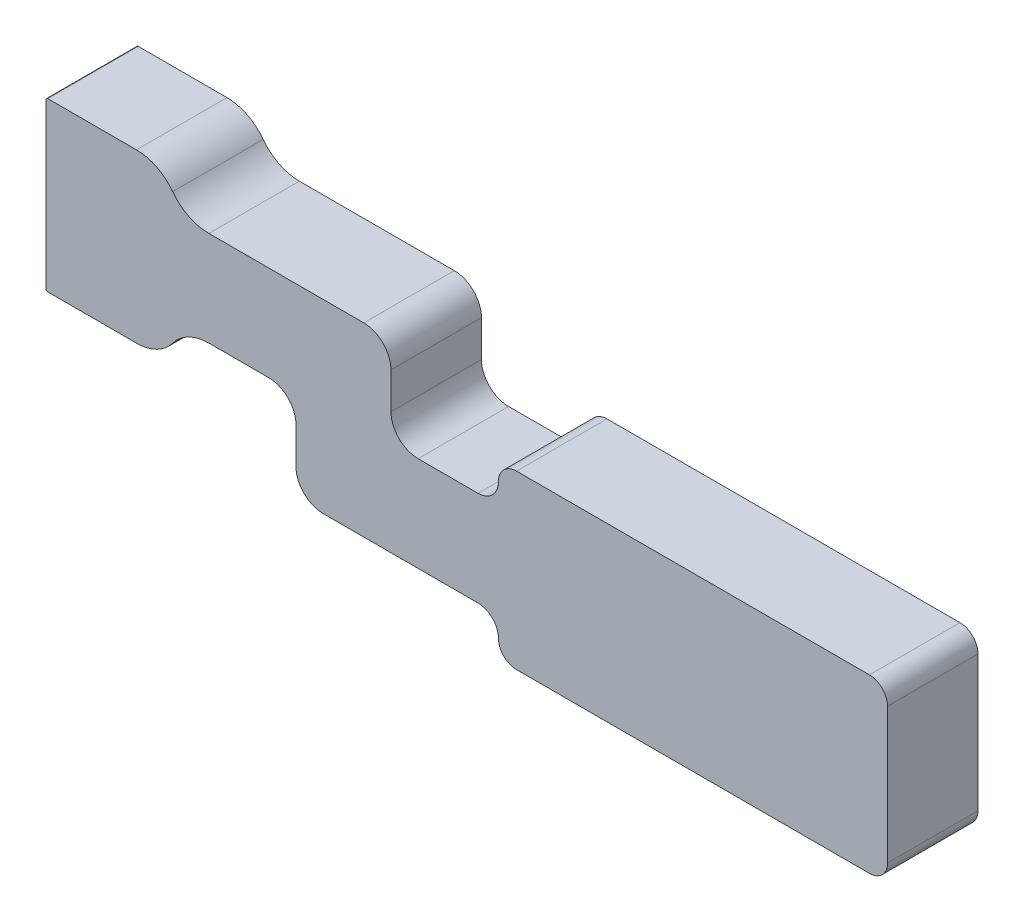
from build123d import *

# Parameters (mm, degrees)
BOSS_EXTRUDE2_DEPTH = 10


with BuildPart() as part:
    # Sketch1 → Boss-Extrude2 (new body)
    with BuildSketch(Plane(origin=(0, 0, 0), x_dir=(0, 1, 0), z_dir=(0, 0, 1))):
        with BuildLine():
            Line((19.25, 83), (19.25, 92.8))
            ThreePointArc((19.25, 92.8), (19.191421356, 92.941421356), (19.05, 93))
            Line((19.05, 93), (0.95, 93))
            ThreePointArc((0.95, 93), (0.808578644, 92.941421356), (0.75, 92.8))
            Line((0.75, 92.8), (0.75, 83))
            ThreePointArc((0.75, 83), (1.277864045, 80.763932023), (2.75, 79))
            ThreePointArc((2.75, 79), (4.222135955, 77.236067977), (4.75, 75))
            Line((4.75, 75), (4.75, 68.375))
            ThreePointArc((4.75, 68.375), (3.871320344, 66.253679656), (1.75, 65.375))
            Line((1.75, 65.375), (-2.25, 65.375))
            ThreePointArc((-2.25, 65.375), (-4.371320344, 64.496320344), (-5.25, 62.375))
            Line((-5.25, 62.375), (-5.25, 45.25))
            ThreePointArc((-5.25, 45.25), (-5.909009742, 43.659009742), (-7.5, 43))
            ThreePointArc((-7.5, 43), (-8.914213562, 42.414213562), (-9.5, 41))
            Line((-9.5, 41), (-9.5, 2))
            ThreePointArc((-9.5, 2), (-8.914213562, 0.585786438), (-7.5, 0))
            Line((-7.5, 0), (7.5, 0))
            ThreePointArc((7.5, 0), (8.914213562, 0.585786438), (9.5, 2))
            Line((9.5, 2), (9.5, 41))
            ThreePointArc((9.5, 41), (8.914213562, 42.414213562), (7.5, 43))
            ThreePointArc((7.5, 43), (5.909009742, 43.659009742), (5.25, 45.25))
            Line((5.25, 45.25), (5.25, 51.875))
            ThreePointArc((5.25, 51.875), (6.128679656, 53.996320344), (8.25, 54.875))
            Line((8.25, 54.875), (12.25, 54.875))
            ThreePointArc((12.25, 54.875), (14.371320344, 55.753679656), (15.25, 57.875))
            Line((15.25, 57.875), (15.25, 75))
            ThreePointArc((15.25, 75), (15.777864045, 77.236067977), (17.25, 79))
            ThreePointArc((17.25, 79), (18.722135955, 80.763932023), (19.25, 83))
        make_face()
    extrude(amount=BOSS_EXTRUDE2_DEPTH)


solid = part.part
